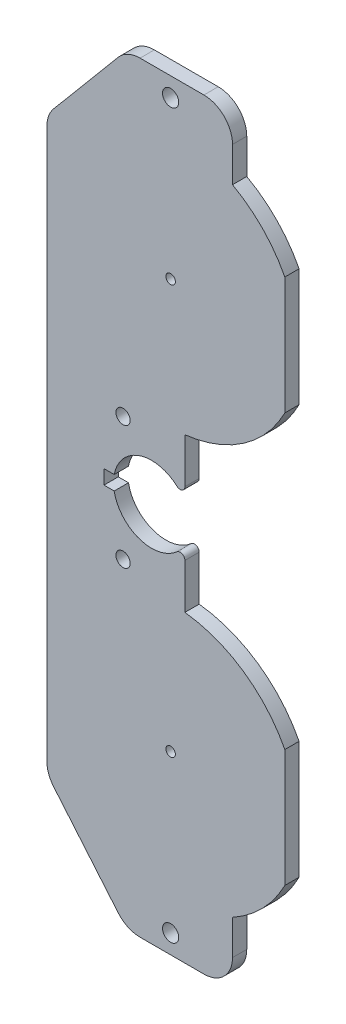
from build123d import *

# Parameters (mm, degrees)
SKETCH_1_R      = 0.85
SKETCH_1_R_2    = 0.5
SKETCH_1_R_3    = 0.75
EXTRUDE_1_DEPTH = 1.5
FILLET_1_R      = 0.5


with BuildPart() as part:
    # Эскиз1 → Бобышка-Вытянуть1 (new body)
    with BuildSketch(Plane.XY):
        with BuildLine():
            Line((-13, 9.091910703), (-13, 66.908089297))
            ThreePointArc((-13, 66.908089297), (-12.819077862, 67.934149727), (-12.298133329, 68.836452126))
            Line((-12.298133329, 68.836452126), (-5.508214043, 76.928362829))
            ThreePointArc((-5.508214043, 76.928362829), (-4.477935499, 77.718923361), (-3.210080714, 78))
            Line((-3.210080714, 78), (3.5, 78))
            ThreePointArc((3.5, 78), (5.621320344, 77.121320344), (6.5, 75))
            Line((6.5, 75), (6.5, 71.332159566))
            ThreePointArc((6.5, 71.332159566), (9.671404616, 68.918807395), (12, 65.684658438))
            Line((12, 65.684658438), (12, 53.315341562))
            ThreePointArc((12, 53.315341562), (7.657483264, 48.381863913), (1.5, 46.083592135))
            Line((1.5, 46.083592135), (1.5, 39.936491673))
            ThreePointArc((1.5, 39.936491673), (-2.630843406, 41.949941341), (-5.929058411, 38.75))
            Line((-5.929058411, 38.75), (-7, 38.75))
            Line((-7, 38.75), (-7, 37.25))
            Line((-7, 37.25), (-5.929058411, 37.25))
            ThreePointArc((-5.929058411, 37.25), (-2.630843406, 34.050058659), (1.5, 36.063508327))
            Line((1.5, 36.063508327), (1.5, 29.916407865))
            ThreePointArc((1.5, 29.916407865), (7.657483264, 27.618136087), (12, 22.684658438))
            Line((12, 22.684658438), (12, 10.315341562))
            ThreePointArc((12, 10.315341562), (9.671404616, 7.081192605), (6.5, 4.667840434))
            Line((6.5, 4.667840434), (6.5, 1))
            ThreePointArc((6.5, 1), (5.621320344, -1.121320344), (3.5, -2))
            Line((3.5, -2), (-3.210080714, -2))
            ThreePointArc((-3.210080714, -2), (-4.477935499, -1.718923361), (-5.508214043, -0.928362829))
            Line((-5.508214043, -0.928362829), (-12.298133329, 7.163547874))
            ThreePointArc((-12.298133329, 7.163547874), (-12.819077862, 8.065850273), (-13, 9.091910703))
        make_face()
        Circle(SKETCH_1_R, mode=Mode.SUBTRACT)
        with Locations((0, 76)):
            Circle(SKETCH_1_R, mode=Mode.SUBTRACT)
        with Locations((0, 16.5)):
            Circle(SKETCH_1_R_2, mode=Mode.SUBTRACT)
        with Locations((0, 59.5)):
            Circle(SKETCH_1_R_2, mode=Mode.SUBTRACT)
        with Locations((-5, 44.5)):
            Circle(SKETCH_1_R_3, mode=Mode.SUBTRACT)
        with Locations((-5, 31.5)):
            Circle(SKETCH_1_R_3, mode=Mode.SUBTRACT)
    extrude(amount=EXTRUDE_1_DEPTH)

    # Скругление1
    fillet_1_edges = [part.edges().sort_by_distance(p)[0] for p in [
        (1.5, 36.063508327, 0.75),
        (1.5, 39.936491673, 0.75),
    ]]
    fillet(fillet_1_edges, radius=FILLET_1_R)


solid = part.part
